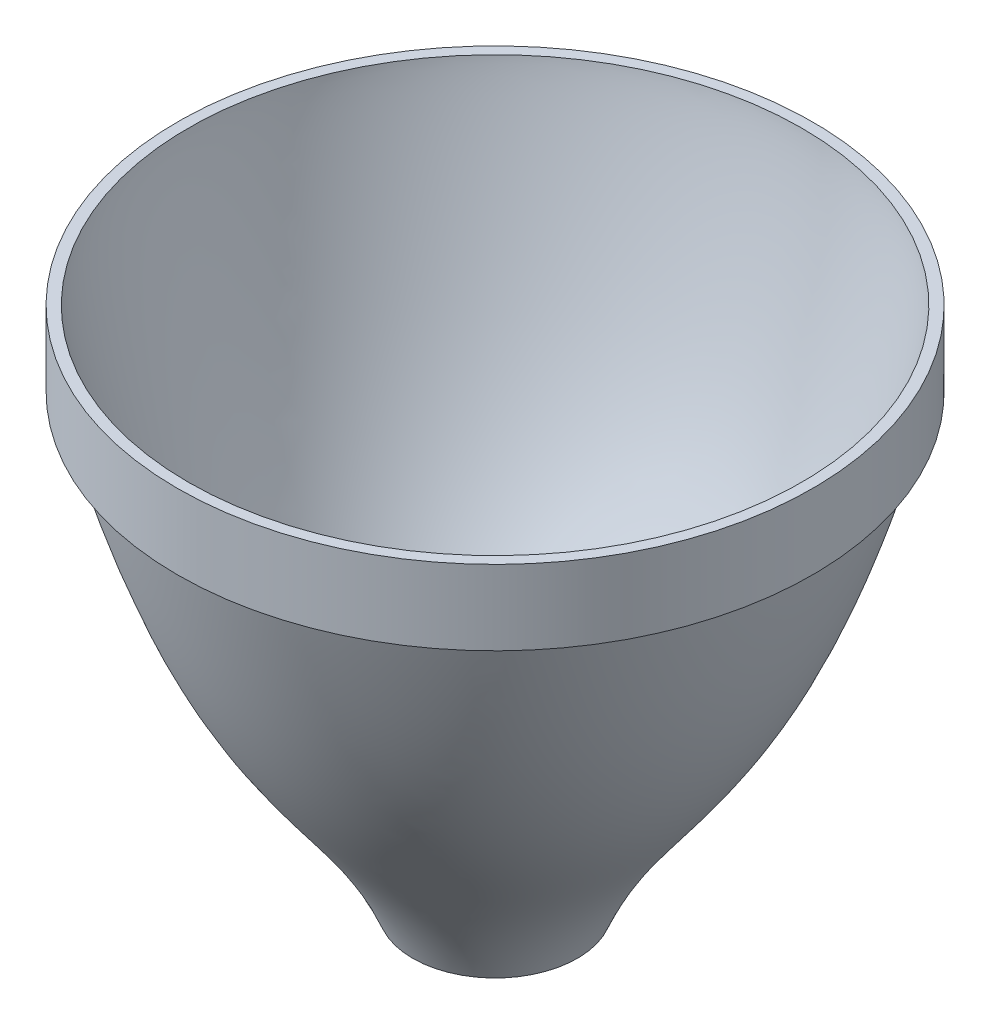
from build123d import *

# Parameters (mm, degrees)
SKETCH1_W = 0.966767554
SKETCH1_H = 6.709997481


with BuildPart() as part:
    # Sketch1 → Revolve1 (revolve)
    with BuildSketch(Plane.XY, mode=Mode.PRIVATE) as revolve1_sk:
        with BuildLine():
            add(Edge.make_bspline(
                [(-2.665787536, 133.12742126), (-2.328851696, 130.569766041), (5.81689345, 99.937667048), (14.34509062, 97.69919767), (18.834212464, 86.67357308)],
                knots=[0, 0, 0, 0, 0.272542359, 1, 1, 1, 1], degree=3))
            Line((-2.665787536, 133.12742126), (-2.665787536, 126.417423779))
            add(Edge.make_bspline(
                [(-2.665787536, 126.417423779), (-2.617585568, 126.238220203), (-2.216772597, 124.759402483), (-1.316669698, 121.621801518), (0.153966794, 117.002853191), (1.736550419, 112.70606711), (3.850380041, 107.834931953), (6.5060834, 103.005558511), (9.613225978, 98.578213661), (12.028471384, 95.451499634), (13.820664247, 92.925526713), (15.096134692, 90.923213241), (16.10737966, 89.073014896), (16.879408077, 87.448556614), (17.264508599, 86.551109823), (17.444950713, 86.10793027)],
                knots=[0.12366547, 0.12366547, 0.12366547, 0.12366547, 0.13147797, 0.1875, 0.25, 0.3125, 0.375, 0.5, 0.625, 0.75, 0.8125, 0.875, 0.9375, 0.96875, 1, 1, 1, 1], degree=3))
            Line((17.444950713, 86.10793027), (18.834212464, 86.67357308))
        make_face()
        with Locations((-3.149171313, 129.772422519)):
            Rectangle(SKETCH1_W, SKETCH1_H)
    revolve(revolve1_sk.sketch.rotate(Axis((24.834212464, 148.471380655, 0), (0, -1, 0)), 270), axis=Axis((24.834212464, 148.471380655, 0), (0, -1, 0)))


solid = part.part
